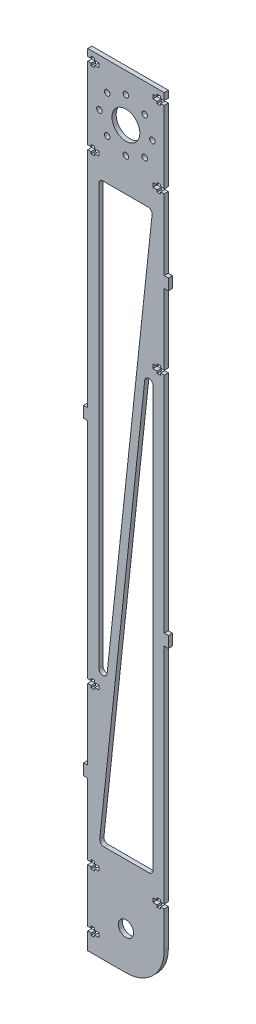
from build123d import *

# Parameters (mm, degrees)
SKETCH_1_R      = 10
SKETCH_1_R_2    = 2
SKETCH_1_R_3    = 5.5
EXTRUDE_1_DEPTH = 3


with BuildPart() as part:
    # 草图1 → 凸台-拉伸1 (new body)
    with BuildSketch(Plane.XY):
        with BuildLine():
            Line((224.953360513, -85.216557036), (224.953360513, -86.716557036))
            Line((224.953360513, -86.716557036), (227.553360513, -86.716557036))
            Line((227.553360513, -86.716557036), (227.553360513, -85.216557036))
            Line((227.553360513, -85.216557036), (230.553360513, -85.216557036))
            Line((230.553360513, -85.216557036), (230.553360513, -82.216557036))
            Line((230.553360513, -82.216557036), (227.553360513, -82.216557036))
            Line((227.553360513, -82.216557036), (227.553360513, -80.716557036))
            Line((227.553360513, -80.716557036), (224.953360513, -80.716557036))
            Line((224.953360513, -80.716557036), (224.953360513, -82.216557036))
            Line((224.953360513, -82.216557036), (222.453360513, -82.216557036))
            Line((222.453360513, -82.216557036), (222.453360513, 78.373187283))
            Line((222.453360513, 78.373187283), (219.453360513, 78.373187283))
            Line((219.453360513, 78.373187283), (219.453360513, 82.373187283))
            Line((219.453360513, 82.373187283), (219.453360513, 86.373187283))
            Line((219.453360513, 86.373187283), (222.453360513, 86.373187283))
            Line((222.453360513, 86.373187283), (222.453360513, 246.962931603))
            Line((222.453360513, 246.962931603), (224.953360513, 246.962931603))
            Line((224.953360513, 246.962931603), (224.953360513, 245.462931603))
            Line((224.953360513, 245.462931603), (227.553360513, 245.462931603))
            Line((227.553360513, 245.462931603), (227.553360513, 246.962931603))
            Line((227.553360513, 246.962931603), (230.553360513, 246.962931603))
            Line((230.553360513, 246.962931603), (230.553360513, 249.962931603))
            Line((230.553360513, 249.962931603), (227.553360513, 249.962931603))
            Line((227.553360513, 249.962931603), (227.553360513, 251.462931603))
            Line((227.553360513, 251.462931603), (224.953360513, 251.462931603))
            Line((224.953360513, 251.462931603), (224.953360513, 249.962931603))
            Line((224.953360513, 249.962931603), (222.453360513, 249.962931603))
            Line((222.453360513, 249.962931603), (222.453360513, 275.962931603))
            Line((222.453360513, 275.962931603), (222.453360513, 301.962931603))
            Line((222.453360513, 301.962931603), (224.953360513, 301.962931603))
            Line((224.953360513, 301.962931603), (224.953360513, 300.462931603))
            Line((224.953360513, 300.462931603), (227.553360513, 300.462931603))
            Line((227.553360513, 300.462931603), (227.553360513, 301.962931603))
            Line((227.553360513, 301.962931603), (230.553360513, 301.962931603))
            Line((230.553360513, 301.962931603), (230.553360513, 304.962931603))
            Line((230.553360513, 304.962931603), (227.553360513, 304.962931603))
            Line((227.553360513, 304.962931603), (227.553360513, 306.462931603))
            Line((227.553360513, 306.462931603), (224.953360513, 306.462931603))
            Line((224.953360513, 306.462931603), (224.953360513, 304.962931603))
            Line((224.953360513, 304.962931603), (222.453360513, 304.962931603))
            Line((222.453360513, 304.962931603), (222.453360513, 309.962931603))
            Line((222.453360513, 309.962931603), (277.453360513, 309.962931603))
            Line((277.453360513, 309.962931603), (277.453360513, 304.962931603))
            Line((277.453360513, 304.962931603), (274.953360513, 304.962931603))
            Line((274.953360513, 304.962931603), (274.953360513, 306.462931603))
            Line((274.953360513, 306.462931603), (272.353360513, 306.462931603))
            Line((272.353360513, 306.462931603), (272.353360513, 304.962931603))
            Line((272.353360513, 304.962931603), (269.353360513, 304.962931603))
            Line((269.353360513, 304.962931603), (269.353360513, 301.962931603))
            Line((269.353360513, 301.962931603), (272.353360513, 301.962931603))
            Line((272.353360513, 301.962931603), (272.353360513, 300.462931603))
            Line((272.353360513, 300.462931603), (274.953360513, 300.462931603))
            Line((274.953360513, 300.462931603), (274.953360513, 301.962931603))
            Line((274.953360513, 301.962931603), (277.453360513, 301.962931603))
            Line((277.453360513, 301.962931603), (277.453360513, 249.962931603))
            Line((277.453360513, 249.962931603), (274.953360513, 249.962931603))
            Line((274.953360513, 249.962931603), (274.953360513, 251.462931603))
            Line((274.953360513, 251.462931603), (272.353360513, 251.462931603))
            Line((272.353360513, 251.462931603), (272.353360513, 249.962931603))
            Line((272.353360513, 249.962931603), (269.353360513, 249.962931603))
            Line((269.353360513, 249.962931603), (269.353360513, 246.962931603))
            Line((269.353360513, 246.962931603), (272.353360513, 246.962931603))
            Line((272.353360513, 246.962931603), (272.353360513, 245.462931603))
            Line((272.353360513, 245.462931603), (274.953360513, 245.462931603))
            Line((274.953360513, 245.462931603), (274.953360513, 246.962931603))
            Line((274.953360513, 246.962931603), (277.453360513, 246.962931603))
            Line((277.453360513, 246.962931603), (277.453360513, 196.052675922))
            Line((277.453360513, 196.052675922), (280.453360513, 196.052675922))
            Line((280.453360513, 196.052675922), (280.453360513, 192.052675922))
            Line((280.453360513, 192.052675922), (280.453360513, 188.052675922))
            Line((280.453360513, 188.052675922), (277.453360513, 188.052675922))
            Line((277.453360513, 188.052675922), (277.453360513, 137.142420241))
            Line((277.453360513, 137.142420241), (274.953360513, 137.142420241))
            Line((274.953360513, 137.142420241), (274.953360513, 138.642420241))
            Line((274.953360513, 138.642420241), (272.353360513, 138.642420241))
            Line((272.353360513, 138.642420241), (272.353360513, 137.142420241))
            Line((272.353360513, 137.142420241), (269.353360513, 137.142420241))
            Line((269.353360513, 137.142420241), (269.353360513, 134.142420241))
            Line((269.353360513, 134.142420241), (272.353360513, 134.142420241))
            Line((272.353360513, 134.142420241), (272.353360513, 132.642420241))
            Line((272.353360513, 132.642420241), (274.953360513, 132.642420241))
            Line((274.953360513, 132.642420241), (274.953360513, 134.142420241))
            Line((274.953360513, 134.142420241), (277.453360513, 134.142420241))
            Line((277.453360513, 134.142420241), (277.453360513, -26.447324078))
            Line((277.453360513, -26.447324078), (280.453360513, -26.447324078))
            Line((280.453360513, -26.447324078), (280.453360513, -30.447324078))
            Line((280.453360513, -30.447324078), (280.453360513, -34.447324078))
            Line((280.453360513, -34.447324078), (277.453360513, -34.447324078))
            Line((277.453360513, -34.447324078), (277.453360513, -195.037068397))
            Line((277.453360513, -195.037068397), (274.953360513, -195.037068397))
            Line((274.953360513, -195.037068397), (274.953360513, -193.537068397))
            Line((274.953360513, -193.537068397), (272.353360513, -193.537068397))
            Line((272.353360513, -193.537068397), (272.353360513, -195.037068397))
            Line((272.353360513, -195.037068397), (269.353360513, -195.037068397))
            Line((269.353360513, -195.037068397), (269.353360513, -198.037068397))
            Line((269.353360513, -198.037068397), (272.353360513, -198.037068397))
            Line((272.353360513, -198.037068397), (272.353360513, -199.537068397))
            Line((272.353360513, -199.537068397), (274.953360513, -199.537068397))
            Line((274.953360513, -199.537068397), (274.953360513, -198.037068397))
            Line((274.953360513, -198.037068397), (277.453360513, -198.037068397))
            Line((277.453360513, -198.037068397), (277.453360513, -224.037068397))
            ThreePointArc((277.453360513, -224.037068397), (269.398796996, -243.48250488), (249.953360513, -251.537068397))
            Line((249.953360513, -251.537068397), (222.453360513, -251.537068397))
            Line((222.453360513, -251.537068397), (222.453360513, -239.287068397))
            Line((222.453360513, -239.287068397), (224.953360513, -239.287068397))
            Line((224.953360513, -239.287068397), (224.953360513, -240.787068397))
            Line((224.953360513, -240.787068397), (227.553360513, -240.787068397))
            Line((227.553360513, -240.787068397), (227.553360513, -239.287068397))
            Line((227.553360513, -239.287068397), (230.553360513, -239.287068397))
            Line((230.553360513, -239.287068397), (230.553360513, -236.287068397))
            Line((230.553360513, -236.287068397), (227.553360513, -236.287068397))
            Line((227.553360513, -236.287068397), (227.553360513, -234.787068397))
            Line((227.553360513, -234.787068397), (224.953360513, -234.787068397))
            Line((224.953360513, -234.787068397), (224.953360513, -236.287068397))
            Line((224.953360513, -236.287068397), (222.453360513, -236.287068397))
            Line((222.453360513, -236.287068397), (222.453360513, -224.037068397))
            Line((222.453360513, -224.037068397), (222.453360513, -198.037068397))
            Line((222.453360513, -198.037068397), (224.953360513, -198.037068397))
            Line((224.953360513, -198.037068397), (224.953360513, -199.537068397))
            Line((224.953360513, -199.537068397), (227.553360513, -199.537068397))
            Line((227.553360513, -199.537068397), (227.553360513, -198.037068397))
            Line((227.553360513, -198.037068397), (230.553360513, -198.037068397))
            Line((230.553360513, -198.037068397), (230.553360513, -195.037068397))
            Line((230.553360513, -195.037068397), (227.553360513, -195.037068397))
            Line((227.553360513, -195.037068397), (227.553360513, -193.537068397))
            Line((227.553360513, -193.537068397), (224.953360513, -193.537068397))
            Line((224.953360513, -193.537068397), (224.953360513, -195.037068397))
            Line((224.953360513, -195.037068397), (222.453360513, -195.037068397))
            Line((222.453360513, -195.037068397), (222.453360513, -144.126812717))
            Line((222.453360513, -144.126812717), (219.453360513, -144.126812717))
            Line((219.453360513, -144.126812717), (219.453360513, -140.126812717))
            Line((219.453360513, -140.126812717), (219.453360513, -136.126812717))
            Line((219.453360513, -136.126812717), (222.453360513, -136.126812717))
            Line((222.453360513, -136.126812717), (222.453360513, -85.216557036))
            Line((222.453360513, -85.216557036), (224.953360513, -85.216557036))
        make_face()
        with Locations((249.953360513, 275.962931603)):
            Circle(SKETCH_1_R, mode=Mode.SUBTRACT)
        with Locations((230.953360513, 275.962931603)):
            Circle(SKETCH_1_R_2, mode=Mode.SUBTRACT)
        with Locations((236.518331671, 289.397960445)):
            Circle(SKETCH_1_R_2, mode=Mode.SUBTRACT)
        with Locations((249.953360513, 294.962931603)):
            Circle(SKETCH_1_R_2, mode=Mode.SUBTRACT)
        with Locations((263.388389356, 289.397960445)):
            Circle(SKETCH_1_R_2, mode=Mode.SUBTRACT)
        with Locations((268.953360513, 275.962931603)):
            Circle(SKETCH_1_R_2, mode=Mode.SUBTRACT)
        with Locations((263.388389356, 262.52790276)):
            Circle(SKETCH_1_R_2, mode=Mode.SUBTRACT)
        with Locations((249.953360513, 256.962931603)):
            Circle(SKETCH_1_R_2, mode=Mode.SUBTRACT)
        with Locations((236.518331671, 262.52790276)):
            Circle(SKETCH_1_R_2, mode=Mode.SUBTRACT)
        with Locations((249.953360513, -224.037068397)):
            Circle(SKETCH_1_R_3, mode=Mode.SUBTRACT)
        with BuildLine():
            Line((233.453360513, 232.962931603), (265.776162867, 232.962931603))
            ThreePointArc((265.776162867, 232.962931603), (268.007619579, 231.968075224), (268.759090329, 229.643332232))
            Line((268.759090329, 229.643332232), (236.436287975, -72.036156407))
            ThreePointArc((236.436287975, -72.036156407), (233.293332993, -74.712285861), (230.453360513, -71.716557036))
            Line((230.453360513, -71.716557036), (230.453360513, 229.962931603))
            ThreePointArc((230.453360513, 229.962931603), (231.33204017, 232.084251946), (233.453360513, 232.962931603))
        make_face(mode=Mode.SUBTRACT)
        with BuildLine():
            Line((269.453360513, 123.642420241), (269.453360513, -178.037068397))
            ThreePointArc((269.453360513, -178.037068397), (268.574680857, -180.158388741), (266.453360513, -181.037068397))
            Line((266.453360513, -181.037068397), (234.130558159, -181.037068397))
            ThreePointArc((234.130558159, -181.037068397), (231.899101447, -180.042212019), (231.147630697, -177.717469026))
            Line((231.147630697, -177.717469026), (263.470433052, 123.962019612))
            ThreePointArc((263.470433052, 123.962019612), (266.613388034, 126.638149066), (269.453360513, 123.642420241))
        make_face(mode=Mode.SUBTRACT)
    extrude(amount=EXTRUDE_1_DEPTH)


solid = part.part
